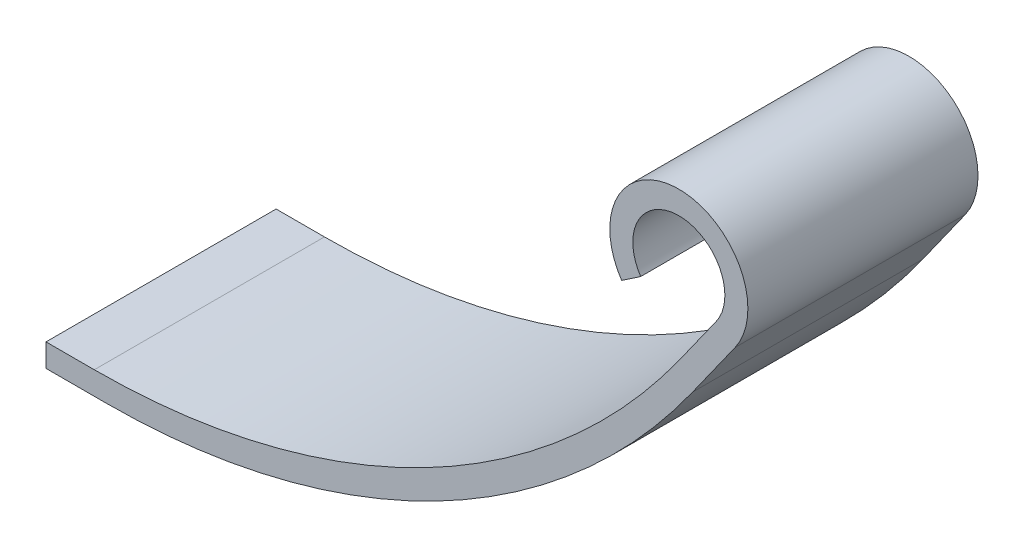
from build123d import *

# Parameters (mm, degrees)
BOSS_EXTRUDE1_DEPTH = 8
FILLET1_R           = 25


with BuildPart() as part:
    # Sketch1 → Boss-Extrude1 (new body)
    with BuildSketch(Plane.XY):
        with BuildLine():
            Line((0, 0), (15, 0))
            Line((15, 0), (23.956669948, 12.610236454))
            ThreePointArc((23.956669948, 12.610236454), (22.027601971, 16.399841272), (20.011882934, 12.655607746))
            Line((20.011882934, 12.655607746), (20.674588623, 13.103738497))
            ThreePointArc((20.674588623, 13.103738497), (22.018401314, 15.599894181), (23.304446632, 13.07349097))
            Line((23.304446632, 13.07349097), (14.586956827, 0.8))
            Line((14.586956827, 0.8), (0, 0.8))
            Line((0, 0.8), (0, 0))
        make_face()
    extrude(amount=BOSS_EXTRUDE1_DEPTH)

    # Fillet1
    fillet1_edges = [part.edges().sort_by_distance(p)[0] for p in [
        (14.586956827, 0.8, 4),
        (15, 0, 4),
    ]]
    fillet(fillet1_edges, radius=FILLET1_R)


solid = part.part
